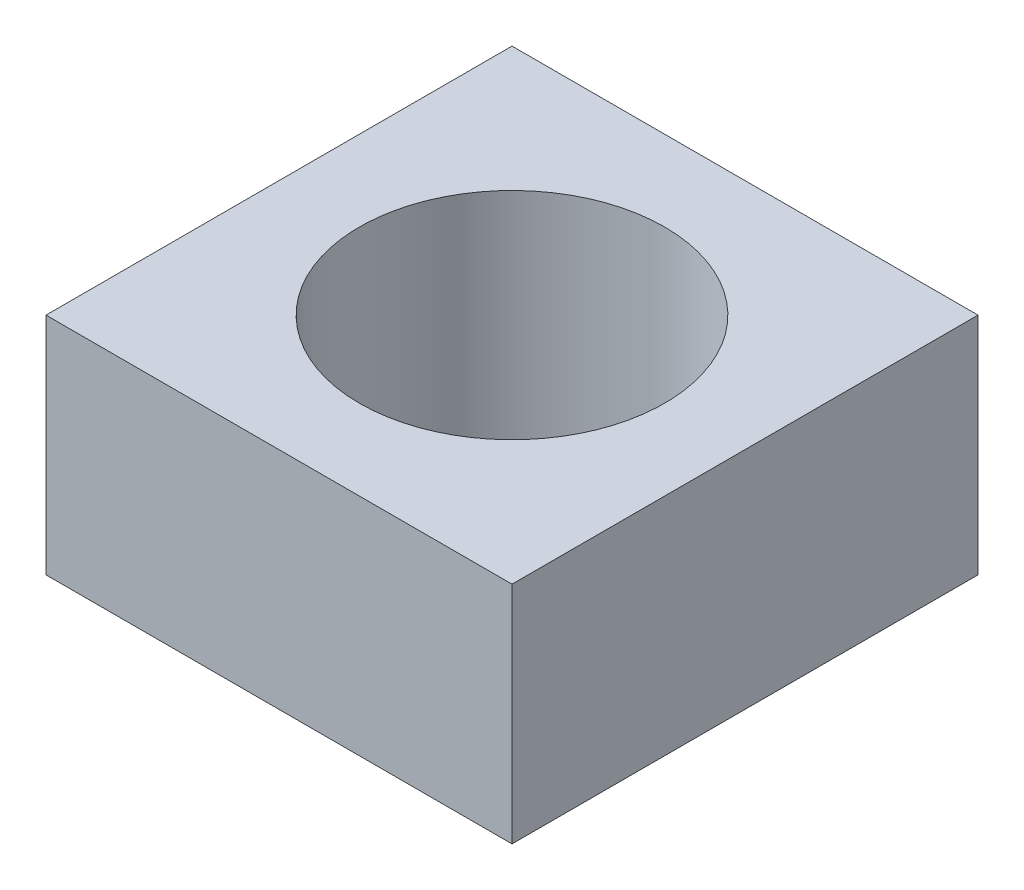
from build123d import *

# Parameters (mm, degrees)
SKETCH1_W           = 14.5
SKETCH1_H           = 14.5
SKETCH1_R           = 4.75
BOSS_EXTRUDE1_DEPTH = 7


with BuildPart() as part:
    # Sketch1 → Boss-Extrude1 (new body)
    with BuildSketch(Plane(origin=(0, 0, 0), x_dir=(1, 0, 0), z_dir=(0, 1, 0))):
        Rectangle(SKETCH1_W, SKETCH1_H)
        Circle(SKETCH1_R, mode=Mode.SUBTRACT)
    extrude(amount=BOSS_EXTRUDE1_DEPTH)


solid = part.part
